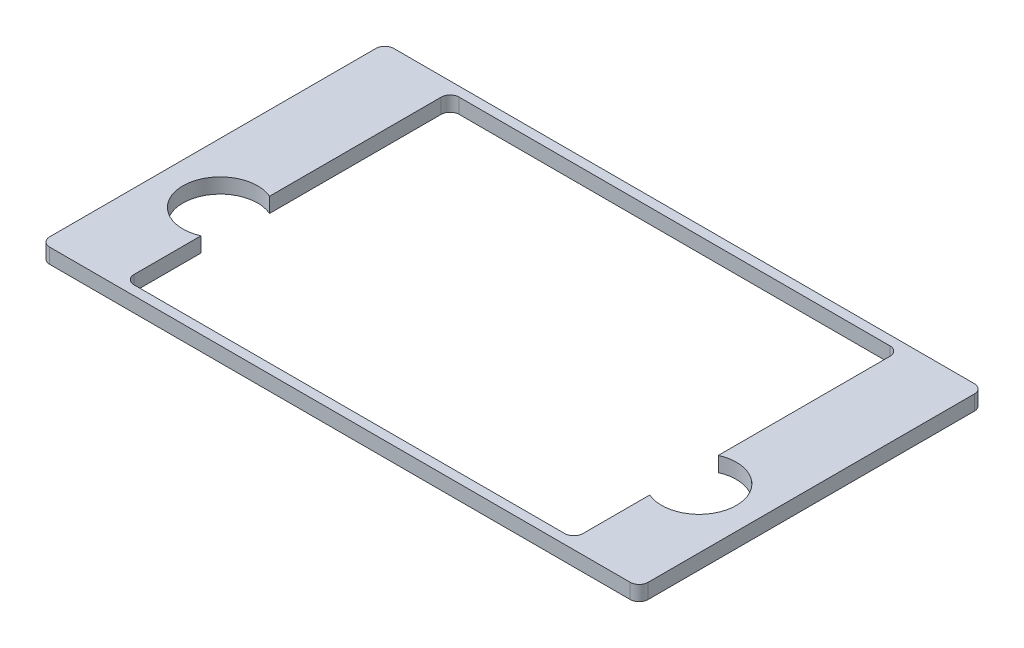
from build123d import *

# Parameters (mm, degrees)
BOSS_EXTRUDE1_DEPTH = 6.35
SKETCH2_R           = 15.875
CUT_EXTRUDE1_DEPTH  = 294.064711284


with BuildPart() as part:
    # Sketch1 → Boss-Extrude1 (new body)
    with BuildSketch(Plane(origin=(0, 0, 0), x_dir=(1, 0, 0), z_dir=(0, 1, 0))):
        with BuildLine():
            Line((3.81, 0), (250.19, 0))
            ThreePointArc((250.19, 0), (252.884076836, 1.115923164), (254, 3.81))
            Line((254, 3.81), (254, 142.24))
            ThreePointArc((254, 142.24), (252.884076836, 144.934076836), (250.19, 146.05))
            Line((250.19, 146.05), (3.81, 146.05))
            ThreePointArc((3.81, 146.05), (1.115923164, 144.934076836), (0, 142.24))
            Line((0, 142.24), (0, 3.81))
            ThreePointArc((0, 3.81), (1.115923164, 1.115923164), (3.81, 0))
        make_face()
        with BuildLine():
            Line((35.56, 142.025), (218.44, 142.025))
            ThreePointArc((218.44, 142.025), (221.134076836, 140.909076836), (222.25, 138.215))
            Line((222.25, 138.215), (222.25, 7.835))
            ThreePointArc((222.25, 7.835), (221.134076836, 5.140923164), (218.44, 4.025))
            Line((218.44, 4.025), (35.56, 4.025))
            ThreePointArc((35.56, 4.025), (32.865923164, 5.140923164), (31.75, 7.835))
            Line((31.75, 7.835), (31.75, 138.215))
            ThreePointArc((31.75, 138.215), (32.865923164, 140.909076836), (35.56, 142.025))
        make_face(mode=Mode.SUBTRACT)
    extrude(amount=BOSS_EXTRUDE1_DEPTH)

    # Sketch2 → Cut-Extrude1 (cut, through all)
    with BuildSketch(Plane(origin=(0, 6.35, 0), x_dir=(1, 0, 0), z_dir=(0, 1, 0))):
        with Locations((25.4, 50.8)):
            Circle(SKETCH2_R)
        with Locations((228.6, 50.8)):
            Circle(SKETCH2_R)
    extrude(amount=-CUT_EXTRUDE1_DEPTH, mode=Mode.SUBTRACT)


solid = part.part
